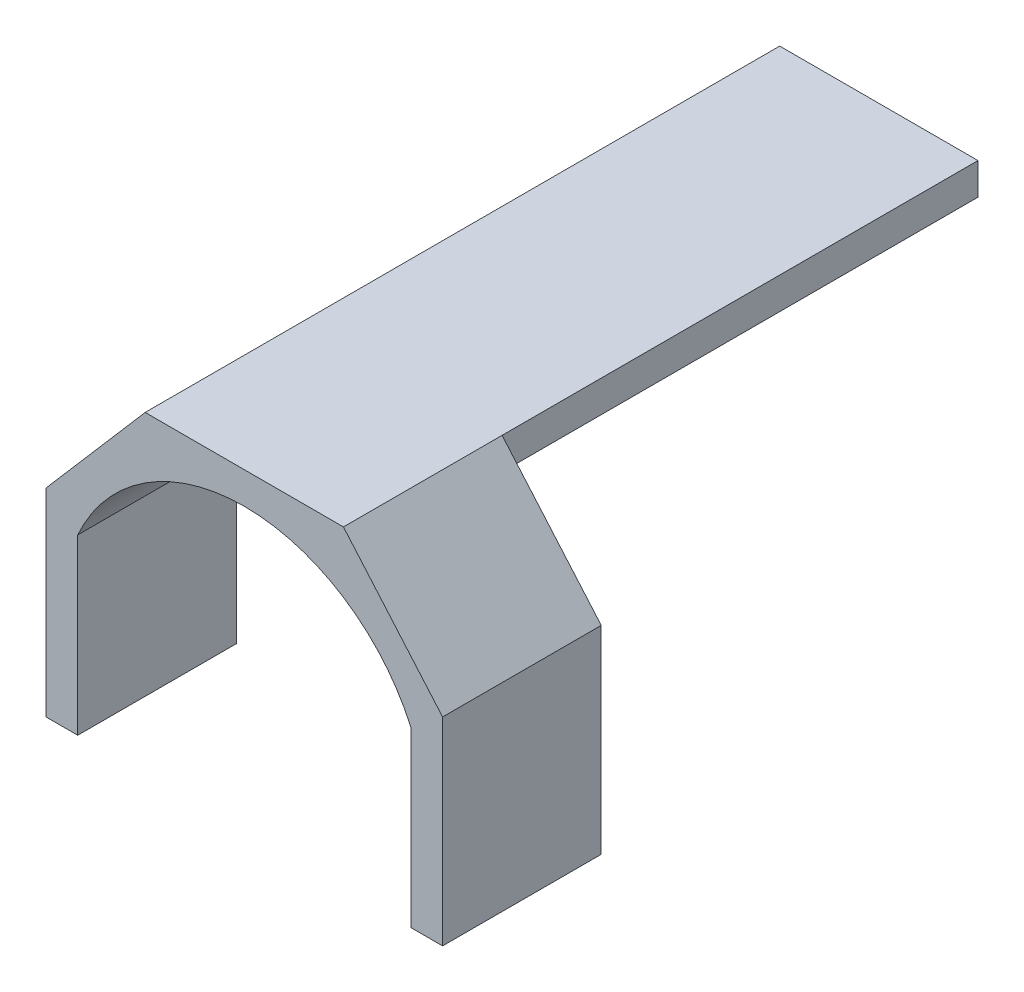
from build123d import *

# Parameters (mm, degrees)
SKETCH_1_W      = 50
SKETCH_1_H      = 8
EXTRUDE_1_DEPTH = 40


with BuildPart() as part:
    # 扫描1: sweep along a path in 草图2
    with BuildLine(Plane(origin=(0, 0, 0), x_dir=(0, 0, -1), z_dir=(1, 0, 0))) as sweep_1_path:
        Line((0, 55.298323556), (-160, 55.298323556))
    # 草图1 → 扫描1 (sweep)
    with BuildSketch(Plane.XY):
        Rectangle(SKETCH_1_W, SKETCH_1_H)
    sweep(path=sweep_1_path.line)

    # 草图4 → 凸台-拉伸1 (add)
    with BuildSketch(Plane.XY.offset(160)):
        with BuildLine():
            Line((-50, -25), (-25, 4))
            Line((-25, 4), (25, 4))
            Line((25, 4), (50, -25))
            Line((50, -25), (50, -75))
            Line((50, -75), (42, -75))
            Line((42, -75), (42, -31.238336961))
            ThreePointArc((42, -31.238336961), (0, -4), (-42, -31.238336961))
            Line((-42, -31.238336961), (-42, -75))
            Line((-42, -75), (-50, -75))
            Line((-50, -75), (-50, -25))
        make_face()
    extrude(amount=-EXTRUDE_1_DEPTH)


solid = part.part
